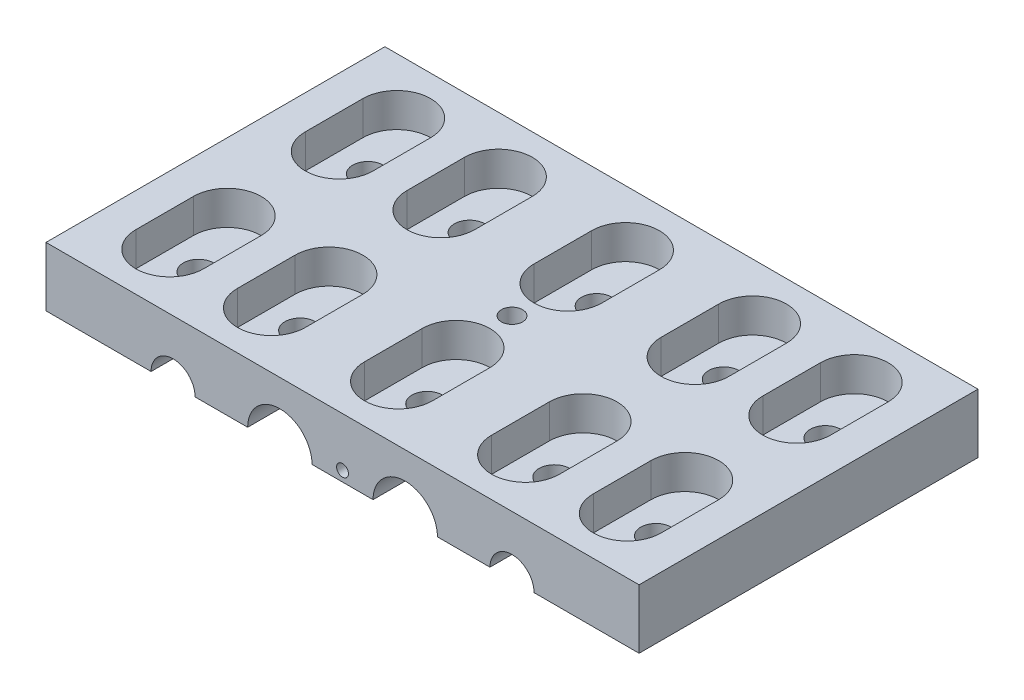
from build123d import *

# Parameters (mm, degrees)
SKETCH1_W           = 88.9
SKETCH1_H           = 50.8
BOSS_EXTRUDE1_DEPTH = 8.89
SKETCH3_R           = 0.889
CUT_EXTRUDE3_DEPTH  = 9.652
CUT_EXTRUDE4_DEPTH  = 69.084319781
CUT_EXTRUDE5_DEPTH  = 69.084319781
CUT_EXTRUDE6_DEPTH  = 69.084319781
SKETCH2_R           = 2.286
CUT_EXTRUDE8_DEPTH  = 5.08
SKETCH11_R          = 2.286
CUT_EXTRUDE9_DEPTH  = 52.961472266
LPATTERN5_COUNT     = 2
LPATTERN5_PITCH     = 25.4
LPATTERN7_COUNT     = 2
LPATTERN7_PITCH     = 25.4
SKETCH12_R          = 1.5875
CUT_EXTRUDE10_DEPTH = 52.961472266
SKETCH13_R          = 0.889
CUT_EXTRUDE11_DEPTH = 9.652


with BuildPart() as part:
    # Sketch1 → Boss-Extrude1 (new body)
    with BuildSketch(Plane(origin=(0, 0, 0), x_dir=(1, 0, 0), z_dir=(0, 1, 0))):
        Rectangle(SKETCH1_W, SKETCH1_H)
    extrude(amount=BOSS_EXTRUDE1_DEPTH)

    # Sketch3 → Cut-Extrude3 (cut)
    with BuildSketch(Plane.XY.offset(25.4)):
        with Locations((6.35, 1.524)):
            Circle(SKETCH3_R)
    extrude(amount=-CUT_EXTRUDE3_DEPTH, mode=Mode.SUBTRACT)

    # Sketch4 → Cut-Extrude4 (cut, through all)
    with BuildSketch(Plane.XY.offset(25.4)):
        with BuildLine():
            Line((4.572, 0), (14.224, 0))
            ThreePointArc((14.224, 0), (9.398, 4.826), (4.572, 0))
        make_face()
    extrude(amount=-CUT_EXTRUDE4_DEPTH, mode=Mode.SUBTRACT)

    # Sketch5 → Cut-Extrude5 (cut, through all)
    with BuildSketch(Plane.XY.offset(25.4)):
        with BuildLine():
            Line((22.098, 0), (28.702, 0))
            ThreePointArc((28.702, 0), (25.4, 3.302), (22.098, 0))
        make_face()
    extrude(amount=-CUT_EXTRUDE5_DEPTH, mode=Mode.SUBTRACT)

    # Sketch6 → Cut-Extrude6 (cut, through all)
    with BuildSketch(Plane.XY.offset(25.4)):
        with BuildLine():
            Line((-28.702, 0), (-22.098, 0))
            ThreePointArc((-22.098, 0), (-25.4, 3.302), (-28.702, 0))
        make_face()
        with BuildLine():
            Line((-14.224, 0), (-4.572, 0))
            ThreePointArc((-4.572, 0), (-9.398, 4.826), (-14.224, 0))
        make_face()
    extrude(amount=-CUT_EXTRUDE6_DEPTH, mode=Mode.SUBTRACT)

    # Sketch2 → Cut-Extrude8 (cut)
    # profile 1 of 5: a face of its own
    with BuildSketch(Plane(origin=(0, 8.89, 0), x_dir=(1, 0, 0), z_dir=(0, 1, 0))):
        with BuildLine():
            Line((-29.21, 17.018), (-29.21, 8.382))
            ThreePointArc((-29.21, 8.382), (-34.29, 3.302), (-39.37, 8.382))
            Line((-39.37, 8.382), (-39.37, 17.018))
            ThreePointArc((-39.37, 17.018), (-34.29, 22.098), (-29.21, 17.018))
        make_face()
        with Locations(Location((-34.29, 12.7, 0), (0, 0, 270))):
            Circle(SKETCH2_R, mode=Mode.SUBTRACT)
    # profile 2 of 5: a face of its own
    with BuildSketch(Plane(origin=(0, 8.89, 0), x_dir=(1, 0, 0), z_dir=(0, 1, 0))):
        with BuildLine():
            Line((-13.97, 17.018), (-13.97, 8.382))
            ThreePointArc((-13.97, 8.382), (-19.05, 3.302), (-24.13, 8.382))
            Line((-24.13, 8.382), (-24.13, 17.018))
            ThreePointArc((-24.13, 17.018), (-19.05, 22.098), (-13.97, 17.018))
        make_face()
        with Locations(Location((-19.05, 12.7, 0), (0, 0, 270))):
            Circle(SKETCH2_R, mode=Mode.SUBTRACT)
    # profile 3 of 5: a face of its own
    with BuildSketch(Plane(origin=(0, 8.89, 0), x_dir=(1, 0, 0), z_dir=(0, 1, 0))):
        with BuildLine():
            Line((5.08, 17.018), (5.08, 8.382))
            ThreePointArc((5.08, 8.382), (0, 3.302), (-5.08, 8.382))
            Line((-5.08, 8.382), (-5.08, 17.018))
            ThreePointArc((-5.08, 17.018), (0, 22.098), (5.08, 17.018))
        make_face()
        with Locations(Location((0, 12.7, 0), (0, 0, 270))):
            Circle(SKETCH2_R, mode=Mode.SUBTRACT)
    # profile 4 of 5: a face of its own
    with BuildSketch(Plane(origin=(0, 8.89, 0), x_dir=(1, 0, 0), z_dir=(0, 1, 0))):
        with BuildLine():
            Line((24.13, 17.018), (24.13, 8.382))
            ThreePointArc((24.13, 8.382), (19.05, 3.302), (13.97, 8.382))
            Line((13.97, 8.382), (13.97, 17.018))
            ThreePointArc((13.97, 17.018), (19.05, 22.098), (24.13, 17.018))
        make_face()
        with Locations(Location((19.05, 12.7, 0), (0, 0, 270))):
            Circle(SKETCH2_R, mode=Mode.SUBTRACT)
    # profile 5 of 5: a face of its own
    with BuildSketch(Plane(origin=(0, 8.89, 0), x_dir=(1, 0, 0), z_dir=(0, 1, 0))):
        with BuildLine():
            Line((39.37, 17.018), (39.37, 8.382))
            ThreePointArc((39.37, 8.382), (34.29, 3.302), (29.21, 8.382))
            Line((29.21, 8.382), (29.21, 17.018))
            ThreePointArc((29.21, 17.018), (34.29, 22.098), (39.37, 17.018))
        make_face()
        with Locations(Location((34.29, 12.7, 0), (0, 0, 270))):
            Circle(SKETCH2_R, mode=Mode.SUBTRACT)
    cut_extrude8 = extrude(amount=-CUT_EXTRUDE8_DEPTH, mode=Mode.SUBTRACT)

    # Sketch11 → Cut-Extrude9 (cut, through all)
    with BuildSketch(Plane(origin=(0, 8.89, 0), x_dir=(1, 0, 0), z_dir=(0, 1, 0))):
        with Locations(Location((-34.29, 12.7, 0), (0, 0, 270))):
            Circle(SKETCH11_R)
        with Locations(Location((-19.05, 12.7, 0), (0, 0, 270))):
            Circle(SKETCH11_R)
        with Locations(Location((0, 12.7, 0), (0, 0, 270))):
            Circle(SKETCH11_R)
        with Locations(Location((19.05, 12.7, 0), (0, 0, 270))):
            Circle(SKETCH11_R)
        with Locations(Location((34.29, 12.7, 0), (0, 0, 270))):
            Circle(SKETCH11_R)
    cut_extrude9 = extrude(amount=-CUT_EXTRUDE9_DEPTH, mode=Mode.SUBTRACT)

    # LPattern5: Cut-Extrude8 ×2
    with Locations(*[(0, 0, i * LPATTERN5_PITCH) for i in range(1, LPATTERN5_COUNT)]):
        add(cut_extrude8, mode=Mode.SUBTRACT)

    # LPattern7: Cut-Extrude9 ×2
    with Locations(*[(0, 0, i * LPATTERN7_PITCH) for i in range(1, LPATTERN7_COUNT)]):
        add(cut_extrude9, mode=Mode.SUBTRACT)

    # Sketch12 → Cut-Extrude10 (cut, through all)
    with BuildSketch(Plane(origin=(0, 8.89, 0), x_dir=(1, 0, 0), z_dir=(0, 1, 0))):
        with Locations(Location((0, 0, 0), (0, 0, 270))):
            Circle(SKETCH12_R)
    extrude(amount=-CUT_EXTRUDE10_DEPTH, mode=Mode.SUBTRACT)

    # Sketch13 → Cut-Extrude11 (cut)
    with BuildSketch(Plane.XY.offset(25.4)):
        with Locations((0, 1.524)):
            Circle(SKETCH13_R)
    extrude(amount=-CUT_EXTRUDE11_DEPTH, mode=Mode.SUBTRACT)


solid = part.part
